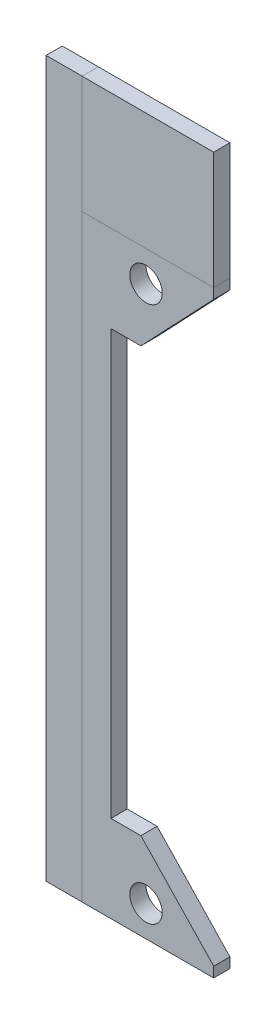
from build123d import *

# Parameters (mm, degrees)
F_3DSKETCH1_R         = 3.175
BOSS_EXTRUDE1_DEPTH   = 3.175
BOSS_EXTRUDE1_2_DEPTH = 3.175
BOSS_EXTRUDE1_3_DEPTH = 3.175


with BuildPart() as part:
    # 3DSketch1 → Boss-Extrude1 (new body)
    with BuildSketch(Plane(origin=(-464.25, 116.5, 0), x_dir=(-0.2742793236442644, -0.961650067655197, 0), z_dir=(0, 0, -1))):
        Polygon((-1.923300135, 0.548558647), (0, 0), (18.333231377, 9.589323609), (19.93776542, 15.214976505), (99.754721035, -7.550207357), (98.150186992, -13.175860253), (108.666457645, -30.993563572), (110.58975778, -31.542122219), (117.652450364, -6.779632977), (5.139392449, 25.311047889), align=None)
        with Locations(Location((108.454058413, -17.154582881, 0), (0, 0, 254.080928829))):
            Circle(F_3DSKETCH1_R, mode=Mode.SUBTRACT)
        with Locations(Location((7.480801309, 11.644746102, 0), (0, 0, 254.080928829))):
            Circle(F_3DSKETCH1_R, mode=Mode.SUBTRACT)
    extrude(amount=-BOSS_EXTRUDE1_DEPTH)


with BuildPart() as body_2:
    # 3DSketch1 → Boss-Extrude1 2 (new body)
    with BuildSketch(Plane(origin=(-464.25, 116.5, 0), x_dir=(-0.2742793236442644, -0.961650067655197, 0), z_dir=(0, 0, -1))):
        Polygon((-24.002556771, 6.845946627), (-1.923300135, 0.548558647), (5.139392449, 25.311047889), (-16.939864187, 31.608435869), align=None)
    extrude(amount=-BOSS_EXTRUDE1_2_DEPTH)


with BuildPart() as body_3:
    # 3DSketch1 → Boss-Extrude1 3 (new body)
    with BuildSketch(Plane(origin=(-464.25, 116.5, 0), x_dir=(-0.2742793236442644, -0.961650067655197, 0), z_dir=(0, 0, -1))):
        Polygon((-16.939864187, 31.608435869), (5.139392449, 25.311047889), (117.652450364, -6.779632977), (119.586119596, 0), (-15.006194955, 38.388068846), align=None)
    extrude(amount=-BOSS_EXTRUDE1_3_DEPTH)


solid = Compound([part.part, body_2.part, body_3.part])
